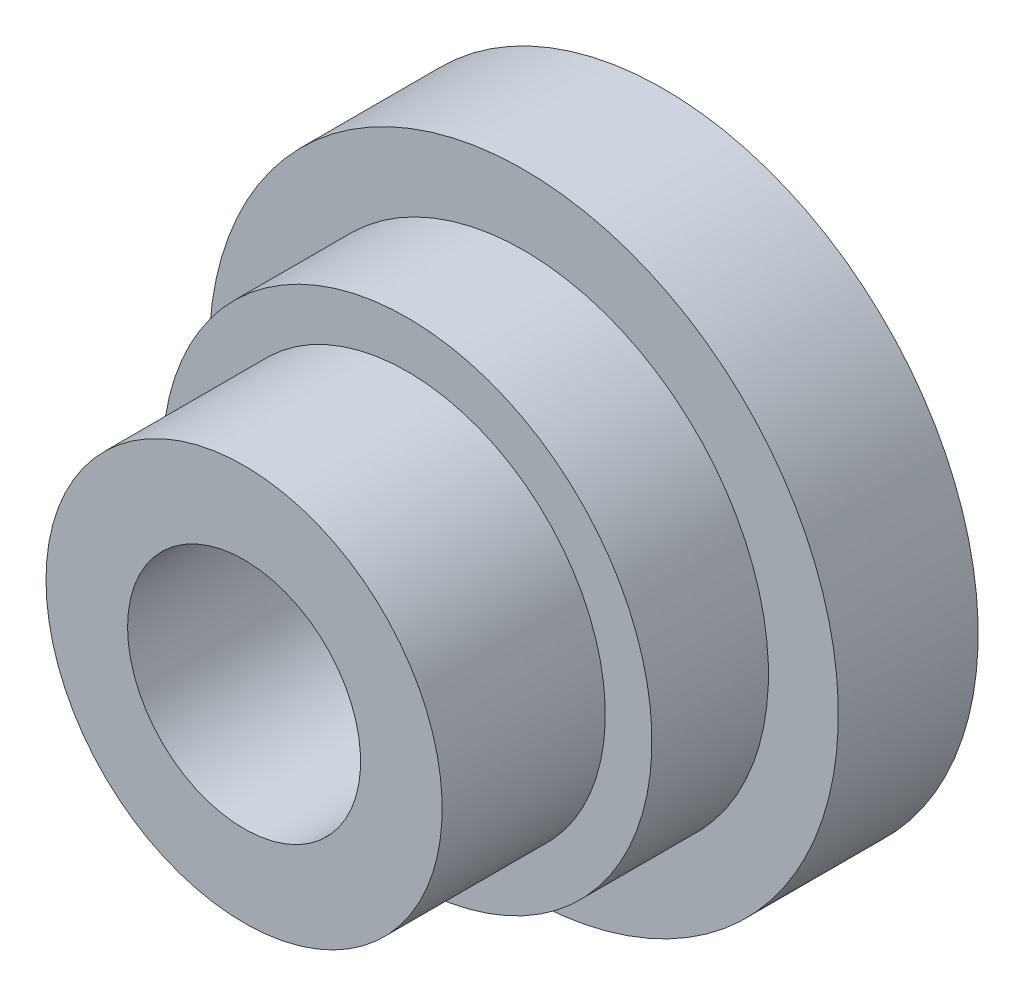
from build123d import *


with BuildPart() as part:
    # 草圖1 → 旋轉1 (revolve)
    with BuildSketch(Plane(origin=(0, 0, 0), x_dir=(0, 0, -1), z_dir=(1, 0, 0)), mode=Mode.PRIVATE) as revolve_1_sk:
        Polygon((0, 10), (0, 27), (-12, 27), (-12, 21), (-22, 21), (-22, 17), (-36, 17), (-36, 10), align=None)
    revolve(revolve_1_sk.sketch.rotate(Axis((0, 0, 0), (0, 0, 1)), 90), axis=Axis((0, 0, 0), (0, 0, 1)))


solid = part.part
